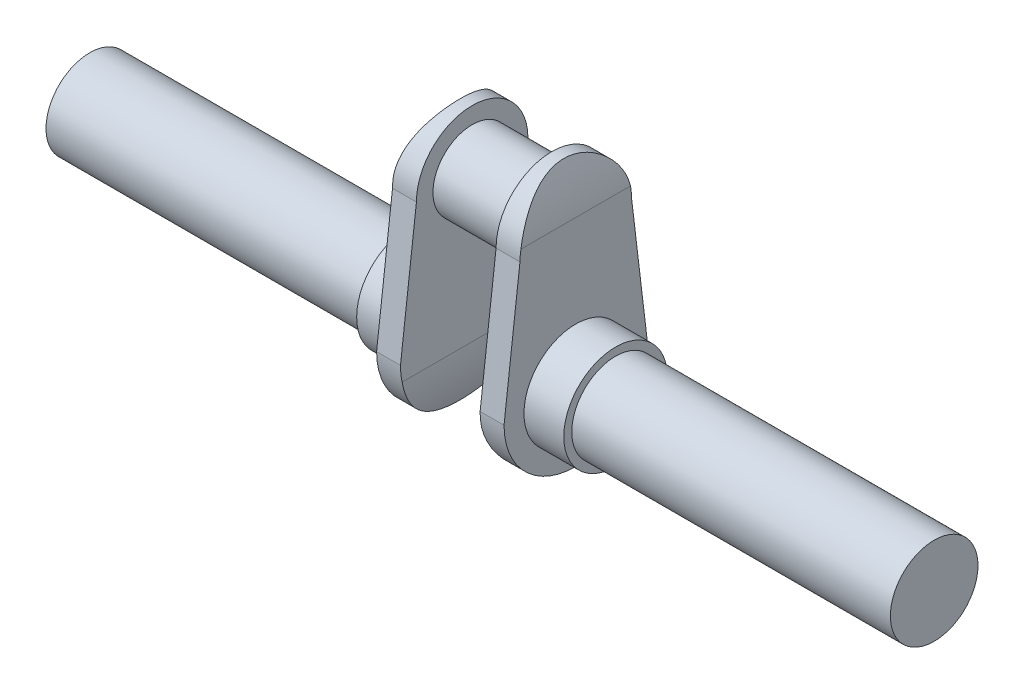
from build123d import *

# Parameters (mm, degrees)
SKETCH1_R               = 20.6375
BOSS_EXTRUDE1_DEPTH     = 9.525
SKETCH2_R               = 20.6375
BOSS_EXTRUDE3_DEPTH     = 15.875
SKETCH3_R               = 15.631220112
BOSS_EXTRUDE4_DEPTH     = 15.875
CUT_EXTRUDE1_DEPTH      = 85.544622325
CUT_EXTRUDE1_DEPTH_BACK = 85.544622325
CUT_EXTRUDE2_DEPTH      = 85.544622414
CUT_EXTRUDE2_DEPTH_BACK = 85.544622414
SKETCH6_R               = 17.4625
BOSS_EXTRUDE5_DEPTH     = 127
BOSS_EXTRUDE6_START     = 127
SKETCH7_R               = 17.4625
BOSS_EXTRUDE6_DEPTH     = 127


with BuildPart() as part:
    # Sketch1 → Boss-Extrude1 (new body)
    # profile 1 of 2: a face of its own
    with BuildSketch(Plane(origin=(0, 0, 0), x_dir=(0, 0, -1), z_dir=(1, 0, 0))):
        with BuildLine():
            ThreePointArc((22.225, 53.18125), (0, 75.40625), (-22.225, 53.18125))
            Line((-22.225, 53.18125), (-27.771661542, 6.727959587))
            Line((-27.771661542, 6.727959587), (-28.575, 0))
            ThreePointArc((-28.575, 0), (0, -28.575), (28.575, 0))
            Line((28.575, 0), (27.771661542, 6.727959587))
            Line((27.771661542, 6.727959587), (22.225, 53.18125))
        make_face()
        Circle(SKETCH1_R, mode=Mode.SUBTRACT)
    # profile 2 of 2: a face of its own
    with BuildSketch(Plane(origin=(0, 0, 0), x_dir=(0, 0, -1), z_dir=(1, 0, 0))):
        Circle(SKETCH1_R)
    extrude(amount=BOSS_EXTRUDE1_DEPTH)

    # Sketch2 → Boss-Extrude3 (add)
    with BuildSketch(Plane.ZY):
        Circle(SKETCH2_R)
    extrude(amount=BOSS_EXTRUDE3_DEPTH)

    # Sketch3 → Boss-Extrude4 (add)
    with BuildSketch(Plane(origin=(9.525, 0, 0), x_dir=(0, 0, -1), z_dir=(1, 0, 0))):
        with Locations((0, 53.18125)):
            Circle(SKETCH3_R)
    extrude(amount=BOSS_EXTRUDE4_DEPTH)

    # Sketch4 → Cut-Extrude1 (cut, two sides: drawn at the far end of the back side and taken through both)
    with BuildSketch(Plane.XY.offset(-CUT_EXTRUDE1_DEPTH_BACK)):
        with BuildLine():
            Line((4.7625, 75.40625), (-6.178104272, 75.40625))
            Line((-6.178104272, 75.40625), (-6.178104272, 53.18125))
            Line((-6.178104272, 53.18125), (0, 53.18125))
            ThreePointArc((0, 53.18125), (0.936646322, 64.603307931), (4.7625, 75.40625))
        make_face()
    extrude(amount=CUT_EXTRUDE1_DEPTH + CUT_EXTRUDE1_DEPTH_BACK, mode=Mode.SUBTRACT)

    # Sketch5 → Cut-Extrude2 (cut, two sides: drawn at the far end of the back side and taken through both)
    with BuildSketch(Plane.XY.offset(-CUT_EXTRUDE2_DEPTH_BACK)):
        with BuildLine():
            Line((4.7625, -28.575), (17.4625, -28.575))
            Line((17.4625, -28.575), (17.4625, 0))
            Line((17.4625, 0), (9.525, 0))
            ThreePointArc((9.525, 0), (8.641404401, -14.537109067), (4.7625, -28.575))
        make_face()
    extrude(amount=CUT_EXTRUDE2_DEPTH + CUT_EXTRUDE2_DEPTH_BACK, mode=Mode.SUBTRACT)

    # Mirror1: part across plane


with BuildPart() as part_1:
    add(part.part)
    add(part.part.mirror(Plane(origin=(25.4, 53.18125, 0), x_dir=(0, 0, 1), z_dir=(1, 0, 0))))

    # Sketch6 → Boss-Extrude5 (add)
    with BuildSketch(Plane.ZY.offset(15.875)):
        Circle(SKETCH6_R)
    extrude(amount=BOSS_EXTRUDE5_DEPTH)

    # Sketch7 → Boss-Extrude6 (add)
    with BuildSketch(Plane(origin=(66.675, 0, 0), x_dir=(0, 0, -1), z_dir=(1, 0, 0)).offset(BOSS_EXTRUDE6_START)):
        with Locations(Location((0, 0, 0), (0, 0, 180))):
            Circle(SKETCH7_R)
    extrude(amount=-BOSS_EXTRUDE6_DEPTH)


solid = part_1.part
